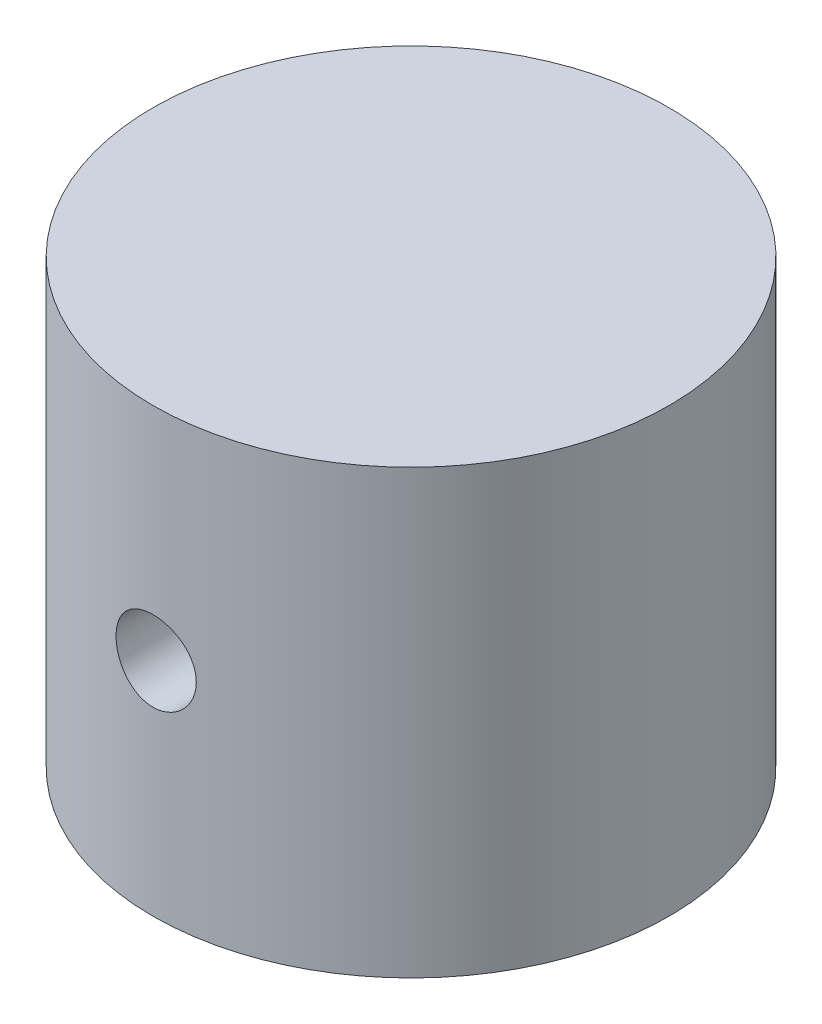
from build123d import *

# Parameters (mm, degrees)
SKETCH1_R           = 11.1125
BOSS_EXTRUDE1_DEPTH = 19.05
SKETCH2_R           = 1.7272
CUT_EXTRUDE1_DEPTH  = 25.695704333


with BuildPart() as part:
    # Sketch1 → Boss-Extrude1 (new body)
    with BuildSketch(Plane(origin=(0, 0, 0), x_dir=(1, 0, 0), z_dir=(0, 1, 0))):
        with Locations(Location((0, 0, 0), (0, 0, 90))):
            Circle(SKETCH1_R)
    extrude(amount=BOSS_EXTRUDE1_DEPTH)

    # Sketch2 → Cut-Extrude1 (cut, through all)
    with BuildSketch(Plane.XY):
        with Locations(Location((0, 9.525, 0), (0, 0, 90))):
            Circle(SKETCH2_R)
    extrude(amount=CUT_EXTRUDE1_DEPTH, mode=Mode.SUBTRACT)


solid = part.part
